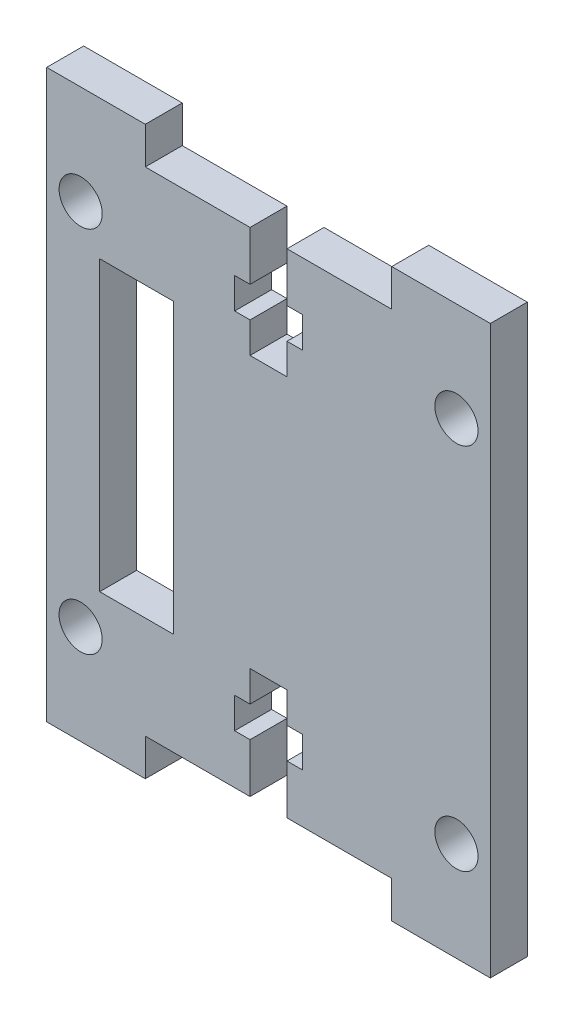
from build123d import *

# Parameters (mm, degrees)
ESBO_O1_R                = 1.75
RESSALTO_EXTRUS_O1_DEPTH = 3


with BuildPart() as part:
    # Esboço1 → Ressalto-extrusão1 (new body)
    with BuildSketch(Plane.XY):
        Polygon((2.25, 0), (-6.25, 0), (-6.25, 2), (-6.25, 3), (-14.25, 3), (-14.25, 2), (-14.25, -42), (-14.25, -43), (-6.25, -43), (-6.25, -42), (-6.25, -40), (2.25, -40), (2.25, -36), (1, -36), (1, -33.5), (2.25, -33.5), (2.25, -31), (5.25, -31), (5.25, -33.5), (6.5, -33.5), (6.5, -36), (5.25, -36), (5.25, -40), (13.75, -40), (13.75, -42), (13.75, -43), (21.75, -43), (21.75, -42), (21.75, 2), (21.75, 3), (13.75, 3), (13.75, 2), (13.75, 0), (5.25, 0), (5.25, -4), (6.5, -4), (6.5, -6.5), (5.25, -6.5), (5.25, -9), (2.25, -9), (2.25, -6.5), (1, -6.5), (1, -4), (2.25, -4), align=None)
        with Locations((19, -5.05)):
            Circle(ESBO_O1_R, mode=Mode.SUBTRACT)
        with Locations((-11.495010855, -5.05)):
            Circle(ESBO_O1_R, mode=Mode.SUBTRACT)
        with Locations((19, -34.95)):
            Circle(ESBO_O1_R, mode=Mode.SUBTRACT)
        with Locations((-11.5, -34.95)):
            Circle(ESBO_O1_R, mode=Mode.SUBTRACT)
        Polygon((-9.95, -8.8), (-9.95, -31.2), (-9.95, -31.7), (-6.95, -31.7), (-3.95, -31.7), (-3.95, -31.2), (-3.95, -8.8), (-3.95, -8.3), (-6.95, -8.3), (-9.95, -8.3), align=None, mode=Mode.SUBTRACT)
    extrude(amount=RESSALTO_EXTRUS_O1_DEPTH)


solid = part.part
